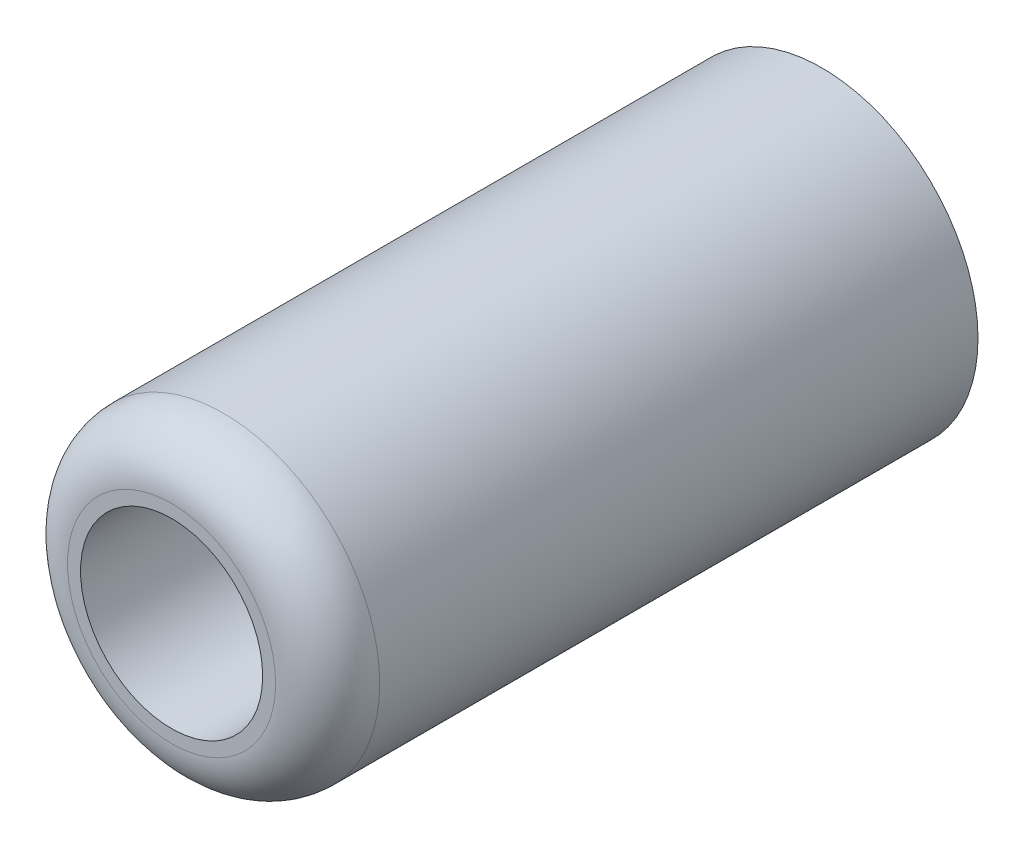
from build123d import *

# Parameters (mm, degrees)
SKETCH_1_R      = 3
SKETCH_1_R_2    = 1.75
EXTRUDE_1_DEPTH = 12.5
FILLET_2_R      = 1


with BuildPart() as part:
    # ｽｹｯﾁ1 → ﾎﾞｽ - 押し出し1 (new body)
    with BuildSketch(Plane.XY):
        Circle(SKETCH_1_R)
        Circle(SKETCH_1_R_2, mode=Mode.SUBTRACT)
    extrude(amount=EXTRUDE_1_DEPTH)

    # ﾌｨﾚｯﾄ2
    fillet_2_edges = [part.edges().sort_by_distance(p)[0] for p in [
        (-3, 0, 12.5),
    ]]
    fillet(fillet_2_edges, radius=FILLET_2_R)


solid = part.part
